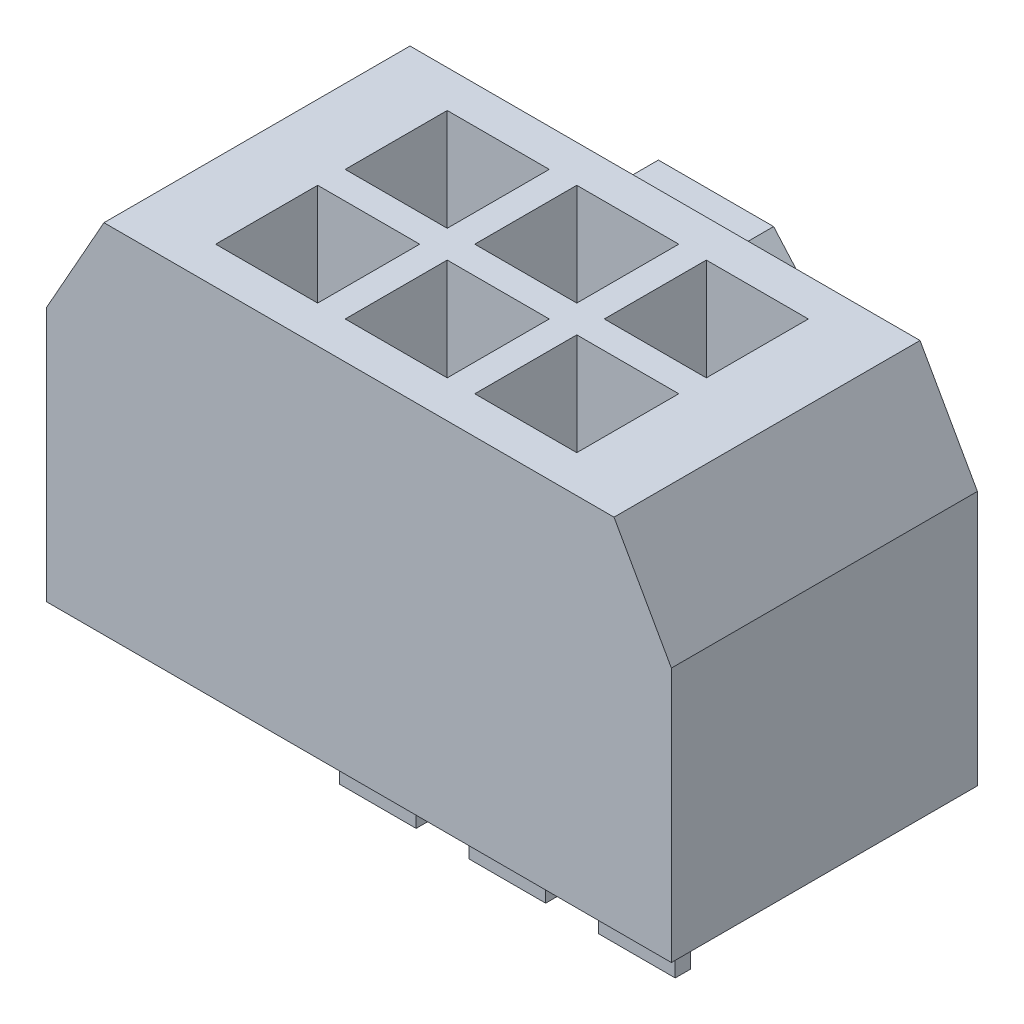
from build123d import *

# Parameters (mm, degrees)
EXTRUDE_1_DEPTH     = 3
EXTRUDE_START       = -4
EXTRUDE_2_DEPTH     = 1
SKETCH_2_W          = 2
SKETCH_2_H          = 2
CUT_EXTRUDE_1_DEPTH = 3
SKETCH_3_W          = 1.5
SKETCH_3_H          = 0.3
EXTRUDE_3_DEPTH     = 2.5


with BuildPart() as part:
    # Эскиз1 → Бобышка-Вытянуть1 (new, symmetric)
    with BuildSketch(Plane.XY):
        Polygon((-6.125, 1.5), (-6.125, -3.5), (-1.9, -3.5), (-1.9, 2.122094745), (-1.129392625, 2.998992793), (1.129392625, 2.998992793), (1.9, 2.122094745), (1.9, -3.5), (6.125, -3.5), (6.125, 1.5), (5, 3.5), (-5, 3.5), align=None)
        Polygon((-1.9, 2.122094745), (-1.9, -3.5), (1.9, -3.5), (1.9, 2.122094745), (1.129392625, 2.998992793), (-1.129392625, 2.998992793), align=None)
    extrude(amount=EXTRUDE_1_DEPTH, both=True)

    # Эскиз1<3> → Бобышка-Вытянуть2 (add)
    with BuildSketch(Plane.XY.offset(EXTRUDE_START)):
        Polygon((-1.9, 2.122094745), (-1.9, -3.5), (1.9, -3.5), (1.9, 2.122094745), (1.129392625, 2.998992793), (-1.129392625, 2.998992793), align=None)
    extrude(amount=EXTRUDE_2_DEPTH)

    # Эскиз2 → Вырез-Вытянуть1 (cut)
    with BuildSketch(Plane(origin=(0, 3.5, 0), x_dir=(1, 0, 0), z_dir=(0, 1, 0))):
        with Locations((0, 1.27)):
            Rectangle(SKETCH_2_W, SKETCH_2_H)
        with Locations((0, -1.27)):
            Rectangle(SKETCH_2_W, SKETCH_2_H)
        with Locations((2.54, 1.27)):
            Rectangle(SKETCH_2_W, SKETCH_2_H)
        with Locations((2.54, -1.27)):
            Rectangle(SKETCH_2_W, SKETCH_2_H)
        with Locations((-2.54, 1.27)):
            Rectangle(SKETCH_2_W, SKETCH_2_H)
        with Locations((-2.54, -1.27)):
            Rectangle(SKETCH_2_W, SKETCH_2_H)
    extrude(amount=-CUT_EXTRUDE_1_DEPTH, mode=Mode.SUBTRACT)

    # Эскиз3 → Бобышка-Вытянуть3 (add)
    with BuildSketch(Plane.XZ.offset(3.5)):
        with Locations((-3.175, -0.575)):
            Rectangle(SKETCH_3_W, SKETCH_3_H)
        with Locations((-1.905, 0.575)):
            Rectangle(SKETCH_3_W, SKETCH_3_H)
        with Locations((-0.635, -0.575)):
            Rectangle(SKETCH_3_W, SKETCH_3_H)
        with Locations((0.635, 0.575)):
            Rectangle(SKETCH_3_W, SKETCH_3_H)
        with Locations((1.905, -0.575)):
            Rectangle(SKETCH_3_W, SKETCH_3_H)
        with Locations((3.175, 0.575)):
            Rectangle(SKETCH_3_W, SKETCH_3_H)
    extrude(amount=EXTRUDE_3_DEPTH)


solid = part.part
